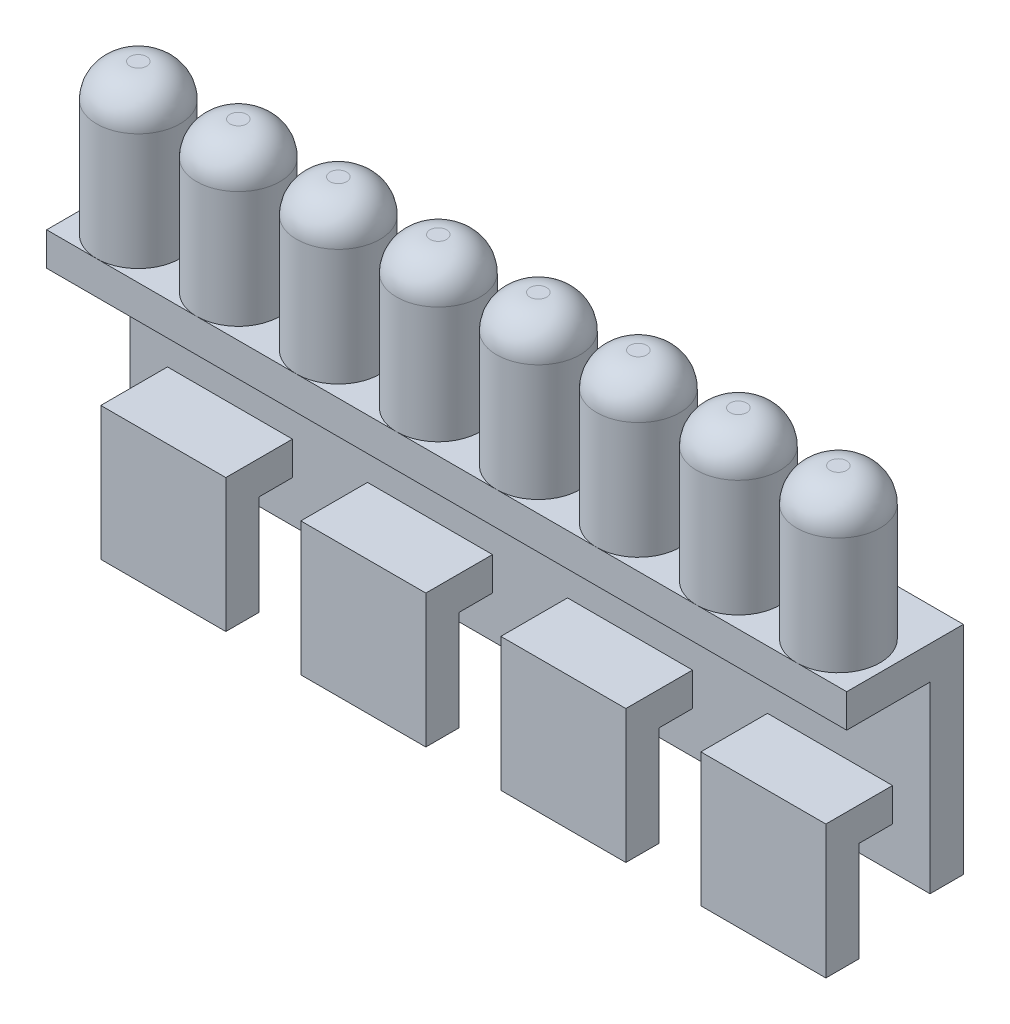
from build123d import *

# Parameters (mm, degrees)
ESQUISSE1_W                      = 12
ESQUISSE1_H                      = 13
BOSS_EXTRU_1_DEPTH               = 2
ESQUISSE2_W                      = 7.5
ESQUISSE2_H                      = 2
BOSS_EXTRU_2_DEPTH               = 4
ESQUISSE3_W                      = 7.5
ESQUISSE3_H                      = 2
BOSS_EXTRU_3_DEPTH               = 6
ESQUISSE4_W                      = 12
ESQUISSE4_H                      = 2
BOSS_EXTRU_4_DEPTH               = 5
ESQUISSE5_R                      = 2.5
BOSS_EXTRU_6_DEPTH               = 9
CONG_1_R                         = 2
ENL_V_MAT_EXTRU_1_REACH          = 19.357
ESQUISSE6_R                      = 1.25
R_P_TITION_LIN_AIRE1_COUNT       = 4
R_P_TITION_LIN_AIRE1_PITCH       = 12
CONG_1_OF_R_P_TITION_LIN_AIRE1_R = 2


with BuildPart() as part:
    # Esquisse1 → Boss.-Extru.1 (new body)
    with BuildSketch(Plane.XY):
        Rectangle(ESQUISSE1_W, ESQUISSE1_H)
    boss_extru_1 = extrude(amount=BOSS_EXTRU_1_DEPTH)

    # Esquisse2 → Boss.-Extru.2 (add)
    with BuildSketch(Plane.XY.offset(2)):
        with Locations((0, -3)):
            Rectangle(ESQUISSE2_W, ESQUISSE2_H)
    boss_extru_2 = extrude(amount=BOSS_EXTRU_2_DEPTH)

    # Esquisse3 → Boss.-Extru.3 (add)
    with BuildSketch(Plane.XZ.offset(4)):
        with Locations((0, 5)):
            Rectangle(ESQUISSE3_W, ESQUISSE3_H)
    boss_extru_3 = extrude(amount=BOSS_EXTRU_3_DEPTH)

    # Esquisse4 → Boss.-Extru.4 (add)
    with BuildSketch(Plane.XY.offset(2)):
        with Locations((0, 5.5)):
            Rectangle(ESQUISSE4_W, ESQUISSE4_H)
    boss_extru_4 = extrude(amount=BOSS_EXTRU_4_DEPTH)

    # Esquisse5 → Boss.-Extru.6 (add)
    with BuildSketch(Plane(origin=(0, 6.5, 0), x_dir=(1, 0, 0), z_dir=(0, 1, 0))):
        with Locations(Location((-3, -4.5, 0), (0, 0, 270))):
            Circle(ESQUISSE5_R)
        with Locations(Location((3, -4.5, 0), (0, 0, 270))):
            Circle(ESQUISSE5_R)
    boss_extru_6 = extrude(amount=BOSS_EXTRU_6_DEPTH)

    # Congé1
    cong_1_edges = [part.edges().sort_by_distance(p)[0] for p in [
        (-3, 15.5, 2),
        (3, 15.5, 2),
    ]]
    fillet(cong_1_edges, radius=CONG_1_R)

    # Esquisse6 → Enlèv. mat.-Extru.1 (cut, up to next)
    with BuildSketch(Plane.XY.offset(2), mode=Mode.PRIVATE) as enl_v_mat_extru_1_sk1:
        with Locations((0, 1.5)):
            Circle(ESQUISSE6_R)
    enl_v_mat_extru_1_tool1 = extrude(enl_v_mat_extru_1_sk1.sketch, amount=-ENL_V_MAT_EXTRU_1_REACH, mode=Mode.PRIVATE) & part.part
    enl_v_mat_extru_1 = enl_v_mat_extru_1_tool1.solids().sort_by_distance((0, 1.5, 2))[0]
    add(enl_v_mat_extru_1, mode=Mode.SUBTRACT)

    # Répétition linéaire1: Boss.-Extru.1, Boss.-Extru.2, Boss.-Extru.3, Boss.-Extru.4, Boss.-Extru.6, Enlèv. mat.-Extru.1 ×4
    with Locations(*[(-i * R_P_TITION_LIN_AIRE1_PITCH, 0, 0) for i in range(1, R_P_TITION_LIN_AIRE1_COUNT)]):
        add(boss_extru_1)
        add(boss_extru_2)
        add(boss_extru_3)
        add(boss_extru_4)
        add(boss_extru_6)
        add(enl_v_mat_extru_1, mode=Mode.SUBTRACT)

    # Congé1 of Répétition linéaire1
    cong_1_of_r_p_tition_lin_aire1_edges = [part.edges().sort_by_distance(p)[0] for p in [
        (-15, 15.5, 2),
        (-9, 15.5, 2),
        (-27, 15.5, 2),
        (-21, 15.5, 2),
        (-39, 15.5, 2),
        (-33, 15.5, 2),
    ]]
    fillet(cong_1_of_r_p_tition_lin_aire1_edges, radius=CONG_1_OF_R_P_TITION_LIN_AIRE1_R)


solid = part.part
